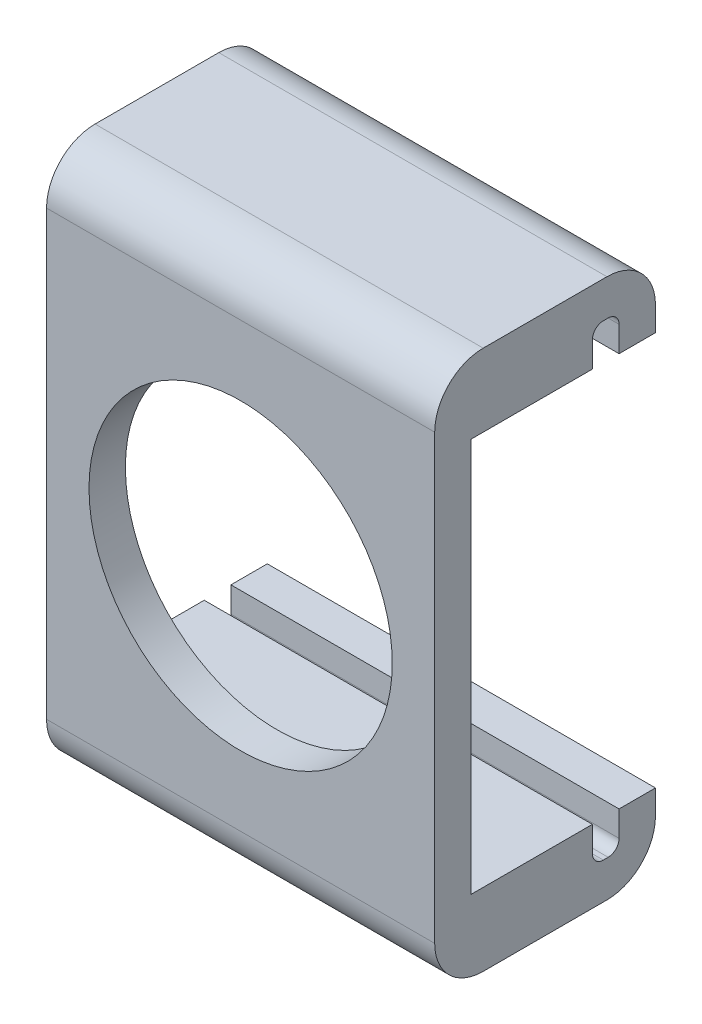
from build123d import *

# Parameters (mm, degrees)
SKIZZE1_W                       = 32
SKIZZE1_H                       = 44.5
AUFSATZ_LINEAR_AUSTRAGEN1_DEPTH = 3
AUFSATZ_LINEAR_AUSTRAGEN2_DEPTH = 32
SKIZZE3_R                       = 12.5
SCHNITT_LINEAR_AUSTRAGEN1_DEPTH = 57.879609703
VERRUNDUNG1_R                   = 4
VERRUNDUNG2_R                   = 4


with BuildPart() as part:
    # Skizze1 → Aufsatz-Linear austragen1 (new body)
    with BuildSketch(Plane.XY):
        with Locations((16, 22.25)):
            Rectangle(SKIZZE1_W, SKIZZE1_H)
    extrude(amount=AUFSATZ_LINEAR_AUSTRAGEN1_DEPTH)

    # Skizze2 → Aufsatz-Linear austragen2 (add, through all)
    with BuildSketch(Plane(origin=(32, 0, 0), x_dir=(0, 0, -1), z_dir=(1, 0, 0))):
        with BuildLine():
            Line((0, 44.5), (15.2, 44.5))
            Line((15.2, 44.5), (15.2, 38.5))
            Line((15.2, 38.5), (12.2, 38.5))
            Line((12.2, 38.5), (12.2, 40.6))
            ThreePointArc((12.2, 40.6), (11.936396103, 41.236396103), (11.3, 41.5))
            Line((11.3, 41.5), (10.9, 41.5))
            ThreePointArc((10.9, 41.5), (10.263603897, 41.236396103), (10, 40.6))
            Line((10, 40.6), (10, 38.5))
            Line((10, 38.5), (-3, 38.5))
            Line((-3, 38.5), (-3, 44.5))
            Line((-3, 44.5), (0, 44.5))
        make_face()
        with BuildLine():
            Line((0, 0), (-3, 0))
            Line((-3, 0), (-3, 6))
            Line((-3, 6), (10, 6))
            Line((10, 6), (10, 3.9))
            ThreePointArc((10, 3.9), (10.263603897, 3.263603897), (10.9, 3))
            Line((10.9, 3), (11.3, 3))
            ThreePointArc((11.3, 3), (11.936396103, 3.263603897), (12.2, 3.9))
            Line((12.2, 3.9), (12.2, 6))
            Line((12.2, 6), (15.2, 6))
            Line((15.2, 6), (15.2, 0))
            Line((15.2, 0), (0, 0))
        make_face()
    extrude(amount=-AUFSATZ_LINEAR_AUSTRAGEN2_DEPTH)

    # Skizze3 → Schnitt-Linear austragen1 (cut, through all)
    with BuildSketch(Plane(origin=(0, 0, 0), x_dir=(-1, 0, 0), z_dir=(0, 0, -1))):
        with Locations((-16, 22.25)):
            Circle(SKIZZE3_R)
    extrude(amount=-SCHNITT_LINEAR_AUSTRAGEN1_DEPTH, mode=Mode.SUBTRACT)

    # Verrundung1
    verrundung1_edges = [part.edges().sort_by_distance(p)[0] for p in [
        (16, 44.5, 3),
        (16, 0, 3),
    ]]
    fillet(verrundung1_edges, radius=VERRUNDUNG1_R)

    # Verrundung2
    verrundung2_edges = [part.edges().sort_by_distance(p)[0] for p in [
        (16, 44.5, -15.2),
        (16, 0, -15.2),
    ]]
    fillet(verrundung2_edges, radius=VERRUNDUNG2_R)


solid = part.part
